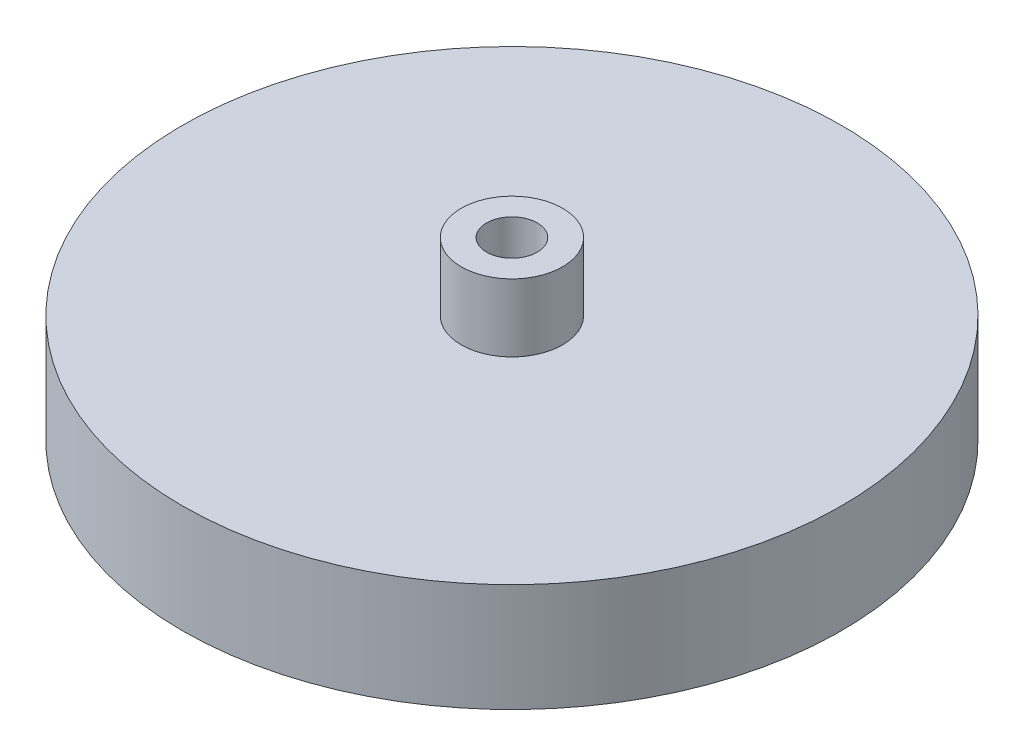
from build123d import *

# Parameters (mm, degrees)
SKETCH1_R           = 61.9125
BOSS_EXTRUDE1_DEPTH = 20.32
SKETCH2_R           = 9.525
BOSS_EXTRUDE2_DEPTH = 12.7
CUT_EXTRUDE1_REACH  = 95.577
SKETCH3_R           = 4.7625


with BuildPart() as part:
    # Sketch1 → Boss-Extrude1 (new body)
    with BuildSketch(Plane(origin=(0, 0, 0), x_dir=(1, 0, 0), z_dir=(0, 1, 0))):
        with Locations(Location((0, 0, 0), (0, 0, 270))):
            Circle(SKETCH1_R)
    extrude(amount=BOSS_EXTRUDE1_DEPTH)

    # Sketch2 → Boss-Extrude2 (add)
    with BuildSketch(Plane(origin=(0, 20.32, 0), x_dir=(1, 0, 0), z_dir=(0, 1, 0))):
        with Locations(Location((0, 0, 0), (0, 0, 270))):
            Circle(SKETCH2_R)
    extrude(amount=BOSS_EXTRUDE2_DEPTH)

    # Sketch3 → Cut-Extrude1 (cut, up to next)
    with BuildSketch(Plane(origin=(0, 33.02, 0), x_dir=(1, 0, 0), z_dir=(0, 1, 0)), mode=Mode.PRIVATE) as cut_extrude1_sk1:
        with Locations(Location((0, 0, 0), (0, 0, 270))):
            Circle(SKETCH3_R)
    cut_extrude1_tool1 = extrude(cut_extrude1_sk1.sketch, amount=-CUT_EXTRUDE1_REACH, mode=Mode.PRIVATE) & part.part
    add(cut_extrude1_tool1.solids().sort_by_distance((0, 33.02, 0))[0], mode=Mode.SUBTRACT)


solid = part.part
